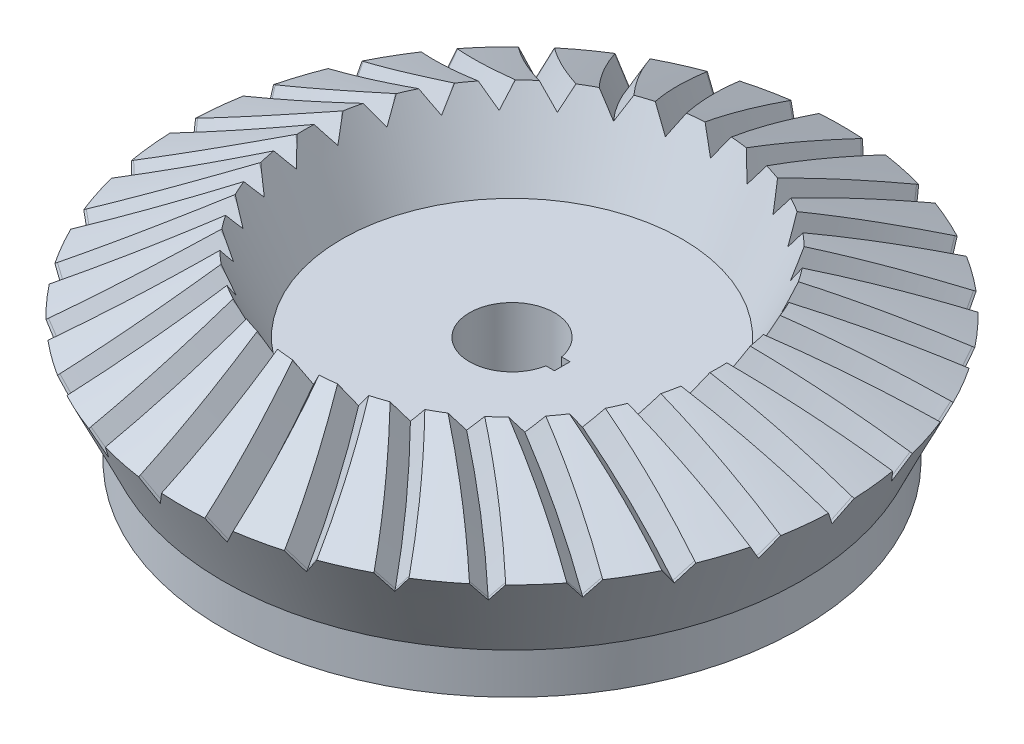
from build123d import *

# Parameters (mm, degrees)
MATRIZC3_COUNT        = 30
CORTAR_EXTRUIR3_DEPTH = 150


with BuildPart() as part:
    # Croquis1 → Revolución1 (revolve)
    with BuildSketch(Plane.XY, mode=Mode.PRIVATE) as revoluci_n1_sk:
        Polygon((0, 0), (0, 40), (50, 40), (60.710750941, 62.589373924), (96.853749219, 45.452172419), (85, 20.452172419), (85, 8.452172419), (20, 8.452172419), (20, 0), align=None)
    revolve(revoluci_n1_sk.sketch.rotate(Axis((0, 0, 0), (0, 1, 0)), 90), axis=Axis((0, 0, 0), (0, 1, 0)))

    # Cortar-Barrer2: sweep along a path in Croquis6
    with BuildLine(Plane(origin=(-35.373111911, 74.603214679, 0), x_dir=(0.9035749569651453, 0.4284300376320922, 0), z_dir=(-0.42843003763209214, 0.9035749569651452, 0))) as cortar_barrer2_path:
        Line((-68.041546343, 1.95), (-67.385899383, 2.011172802))
        ThreePointArc((-67.385899383, 2.011172802), (-47.251668745, 4.579345516), (-27.337178814, 8.503099498))
        Line((-27.337178814, 8.503099498), (-26.784196488, 8.631628352))
    # Croquis2 → Cortar-Barrer2 (sweep, cut)
    with BuildSketch(Plane(origin=(-61.480637309, -29.15104226, 0), x_dir=(0, 0, 1), z_dir=(-0.9035749569651452, -0.4284300376320921, 0))):
        Polygon((0, 76.001350542), (3.9, 82.756348692), (-3.9, 82.756348692), align=None)
    cortar_barrer2 = sweep(path=cortar_barrer2_path.line, mode=Mode.SUBTRACT)

    # MatrizC3: Cortar-Barrer2 ×30 about axis
    matrizc3_axis = Axis((0, 45.452172419, 0), (0, -1, 0))
    for i in range(1, MATRIZC3_COUNT):
        add(cortar_barrer2.rotate(matrizc3_axis, i * 360 / MATRIZC3_COUNT), mode=Mode.SUBTRACT)

    # Croquis7 → Cortar-Extruir3 (cut)
    with BuildSketch(Plane.XZ):
        with BuildLine():
            Line((12.287395603, -2.295628299), (14.766852995, -2.295628299))
            Line((14.766852995, -2.295628299), (14.766852995, 2.295628299))
            Line((14.766852995, 2.295628299), (12.287395603, 2.295628299))
            ThreePointArc((12.287395603, 2.295628299), (-12.5, 0), (12.287395603, -2.295628299))
        make_face()
    extrude(amount=-CORTAR_EXTRUIR3_DEPTH, mode=Mode.SUBTRACT)


solid = part.part
